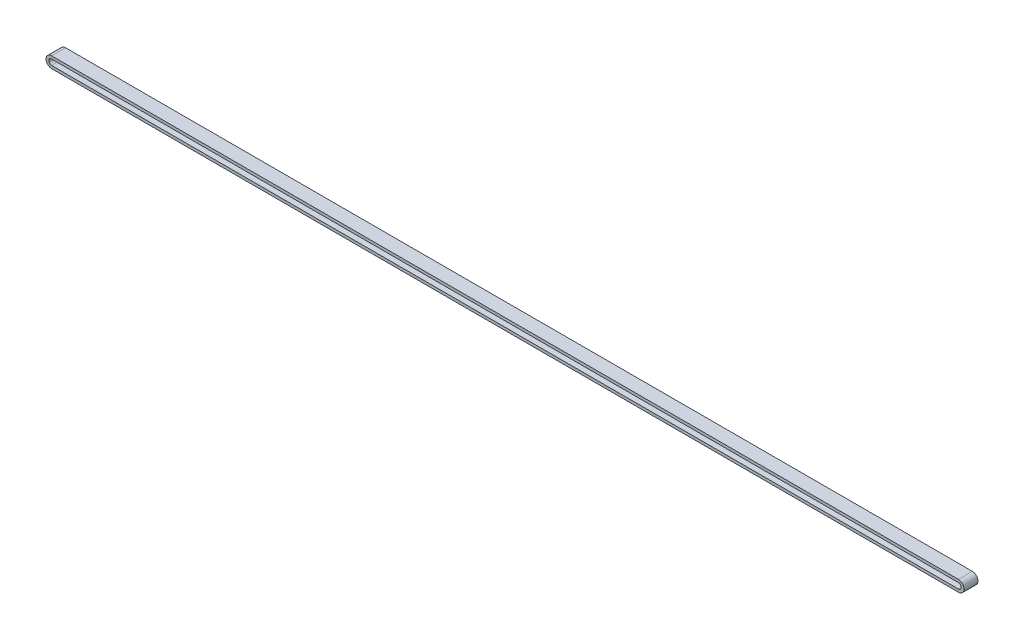
from build123d import *

# Parameters (mm, degrees)
EXTRUDE_1_DEPTH = 5


with BuildPart() as part:
    # 草图1 → 凸台-拉伸1 (new body)
    with BuildSketch(Plane.XY):
        with BuildLine():
            Line((0, -2), (325.00227405, -2))
            ThreePointArc((325.00227405, -2), (327.00227405, 0), (325.00227405, 2))
            Line((325.00227405, 2), (0, 2))
            ThreePointArc((0, 2), (-2, 0), (0, -2))
        make_face()
        with BuildLine():
            ThreePointArc((325.00227405, 1), (326.00227405, 0), (325.00227405, -1))
            Line((325.00227405, -1), (0, -1))
            ThreePointArc((0, -1), (-1, 0), (0, 1))
            Line((0, 1), (325.00227405, 1))
        make_face(mode=Mode.SUBTRACT)
    extrude(amount=EXTRUDE_1_DEPTH)


solid = part.part
